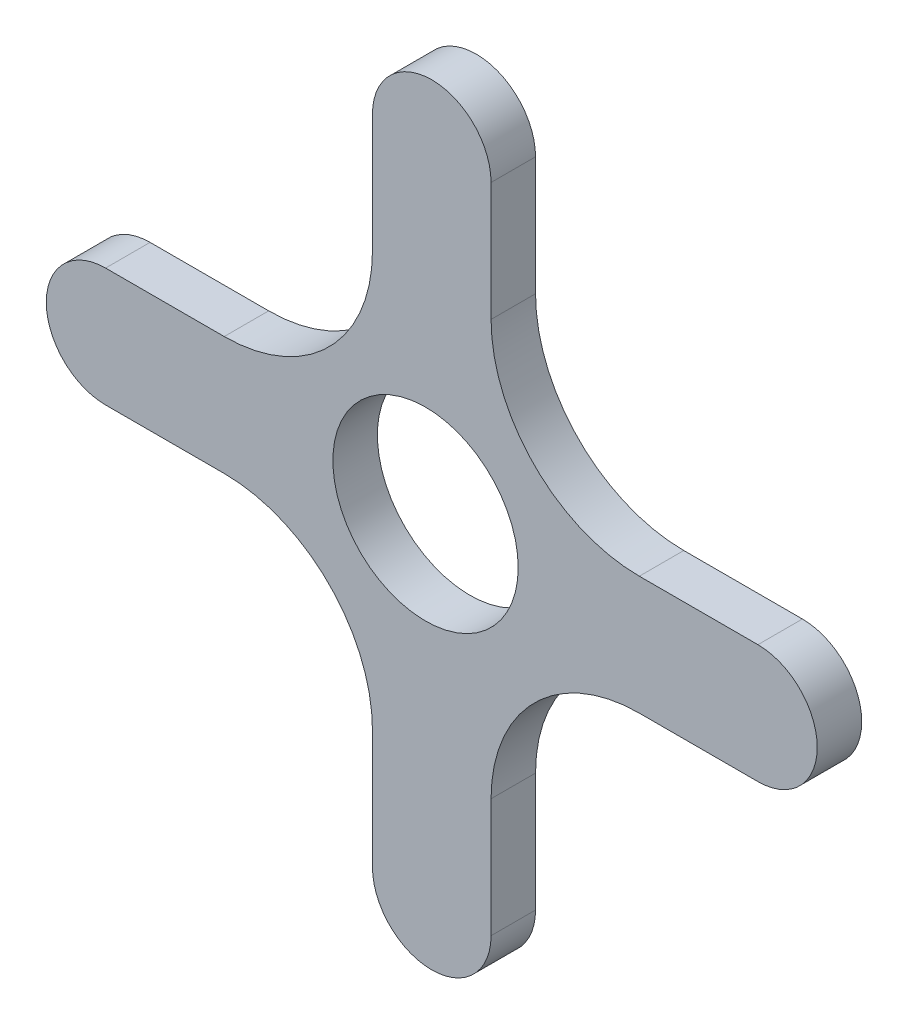
from build123d import *

# Parameters (mm, degrees)
SKETCH1_R           = 6.25
BOSS_EXTRUDE1_DEPTH = 3


with BuildPart() as part:
    # Sketch1 → Boss-Extrude1 (new body)
    with BuildSketch(Plane.XY):
        with BuildLine():
            Line((-3.580582618, -22.419417382), (-3.580582618, -14.419417382))
            ThreePointArc((-3.580582618, -14.419417382), (-6.509514806, -7.348349571), (-13.580582618, -4.419417382))
            Line((-13.580582618, -4.419417382), (-21.580582618, -4.419417382))
            ThreePointArc((-21.580582618, -4.419417382), (-25.580582618, -0.419417382), (-21.580582618, 3.580582618))
            Line((-21.580582618, 3.580582618), (-13.580582618, 3.580582618))
            ThreePointArc((-13.580582618, 3.580582618), (-6.509514806, 6.509514806), (-3.580582618, 13.580582618))
            Line((-3.580582618, 13.580582618), (-3.580582618, 21.580582618))
            ThreePointArc((-3.580582618, 21.580582618), (0.419417382, 25.580582618), (4.419417382, 21.580582618))
            Line((4.419417382, 21.580582618), (4.419417382, 13.580582618))
            ThreePointArc((4.419417382, 13.580582618), (7.348349571, 6.509514806), (14.419417382, 3.580582618))
            Line((14.419417382, 3.580582618), (22.419417382, 3.580582618))
            ThreePointArc((22.419417382, 3.580582618), (26.419417382, -0.419417382), (22.419417382, -4.419417382))
            Line((22.419417382, -4.419417382), (14.419417382, -4.419417382))
            ThreePointArc((14.419417382, -4.419417382), (7.348349571, -7.348349571), (4.419417382, -14.419417382))
            Line((4.419417382, -14.419417382), (4.419417382, -22.419417382))
            ThreePointArc((4.419417382, -22.419417382), (0.419417382, -26.419417382), (-3.580582618, -22.419417382))
        make_face()
        Circle(SKETCH1_R, mode=Mode.SUBTRACT)
    extrude(amount=BOSS_EXTRUDE1_DEPTH)


solid = part.part
